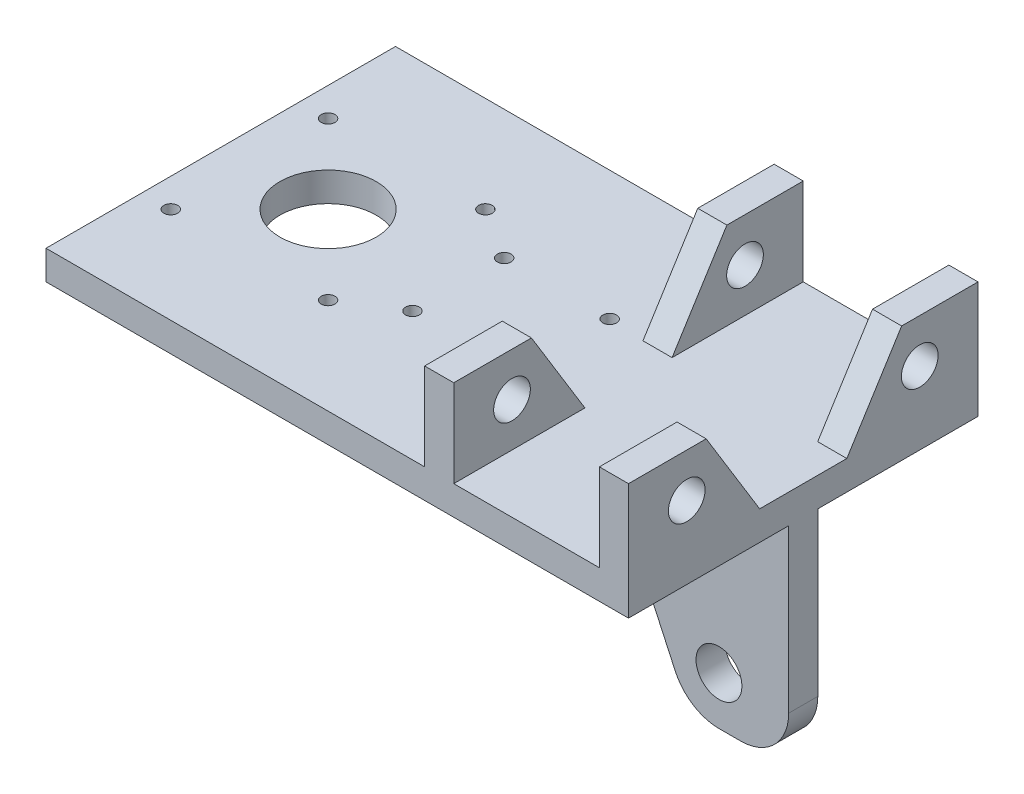
from build123d import *

# Parameters (mm, degrees)
SKETCH2_W           = 127
SKETCH2_H           = 76.2
SKETCH2_R           = 10.5
SKETCH2_R_2         = 1.5
BOSS_EXTRUDE1_DEPTH = 6.35
SKETCH3_R           = 4
BOSS_EXTRUDE2_DEPTH = 6.35
LPATTERN1_COUNT     = 2
LPATTERN1_PITCH     = 38.1
BOSS_EXTRUDE3_START = -38.1
SKETCH4_R           = 5
BOSS_EXTRUDE3_DEPTH = 3.175


with BuildPart() as part:
    # Sketch2 → Boss-Extrude1 (new body)
    with BuildSketch(Plane(origin=(0, 0, 0), x_dir=(1, 0, 0), z_dir=(0, 1, 0))):
        Rectangle(SKETCH2_W, SKETCH2_H)
        with Locations(Location((-40.1, 0, 0), (0, 0, 270))):
            Circle(SKETCH2_R, mode=Mode.SUBTRACT)
        with Locations(Location((11.3, 10, 0), (0, 0, 270))):
            Circle(SKETCH2_R_2, mode=Mode.SUBTRACT)
        with Locations(Location((-57.25, 17.15, 0), (0, 0, 270))):
            Circle(SKETCH2_R_2, mode=Mode.SUBTRACT)
        with Locations(Location((-57.25, -17.15, 0), (0, 0, 90))):
            Circle(SKETCH2_R_2, mode=Mode.SUBTRACT)
        with Locations(Location((-11.7, 10, 0), (0, 0, 90))):
            Circle(SKETCH2_R_2, mode=Mode.SUBTRACT)
        with Locations(Location((-22.95, -17.15, 0), (0, 0, 270))):
            Circle(SKETCH2_R_2, mode=Mode.SUBTRACT)
        with Locations(Location((-22.95, 17.15, 0), (0, 0, 90))):
            Circle(SKETCH2_R_2, mode=Mode.SUBTRACT)
        with Locations(Location((11.3, -10, 0), (0, 0, 90))):
            Circle(SKETCH2_R_2, mode=Mode.SUBTRACT)
        with Locations(Location((-11.7, -10, 0), (0, 0, 270))):
            Circle(SKETCH2_R_2, mode=Mode.SUBTRACT)
    extrude(amount=BOSS_EXTRUDE1_DEPTH)

    # Sketch3 → Boss-Extrude2 (add)
    with BuildSketch(Plane(origin=(63.5, 0, 0), x_dir=(0, 0, -1), z_dir=(1, 0, 0))):
        Polygon((-38.1, 0), (38.1, 0), (38.1, 25.4), (21.451862696, 25.4), (9.5, 6.35), (-9.5, 6.35), (-21.165528848, 25.4), (-38.1, 25.4), align=None)
        with Locations((-25.4, 15.875)):
            Circle(SKETCH3_R, mode=Mode.SUBTRACT)
        with Locations((25.4, 15.875)):
            Circle(SKETCH3_R, mode=Mode.SUBTRACT)
    boss_extrude2 = extrude(amount=-BOSS_EXTRUDE2_DEPTH)

    # LPattern1: Boss-Extrude2 ×2
    with Locations(*[(-i * LPATTERN1_PITCH, 0, 0) for i in range(1, LPATTERN1_COUNT)]):
        add(boss_extrude2)

    # Sketch4 → Boss-Extrude3 (add, symmetric)
    with BuildSketch(Plane(origin=(0, 0, -38.1), x_dir=(-1, 0, 0), z_dir=(0, 0, -1)).offset(BOSS_EXTRUDE3_START)):
        with BuildLine():
            Line((-63.5, 0), (-20.400000165, 0))
            Line((-20.400000165, 0), (-38.766166206, -39.799546929))
            ThreePointArc((-38.766166206, -39.799546929), (-42.640726317, -44.24435534), (-48.3, -45.9))
            Line((-48.3, -45.9), (-53, -45.9))
            ThreePointArc((-53, -45.9), (-60.424621202, -42.824621202), (-63.5, -35.4))
            Line((-63.5, -35.4), (-63.5, 0))
        make_face()
        with Locations((-48.3, -35.4)):
            Circle(SKETCH4_R, mode=Mode.SUBTRACT)
    extrude(amount=BOSS_EXTRUDE3_DEPTH, both=True)


solid = part.part
